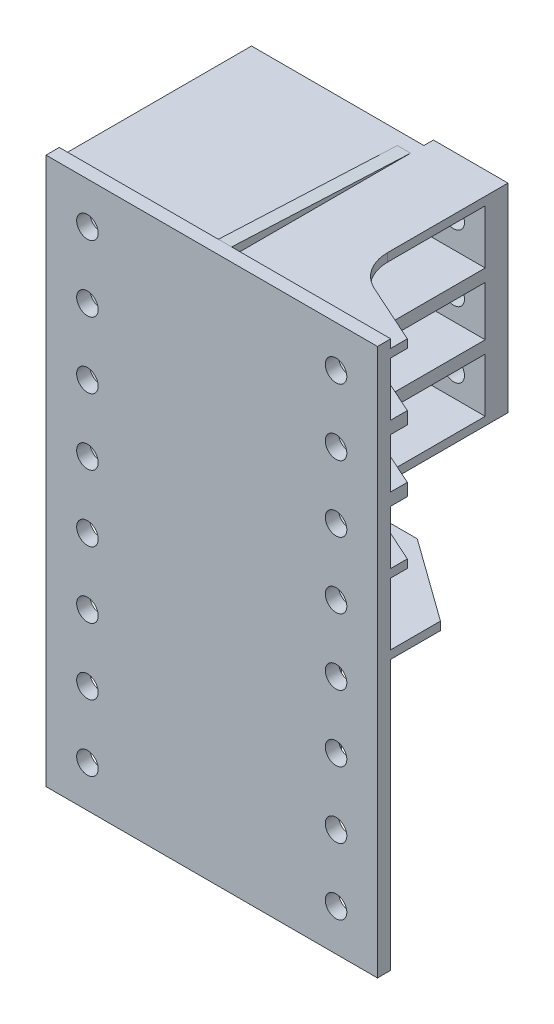
from build123d import *

# Parameters (mm, degrees)
SKETCH_1_W                       = 400
SKETCH_1_H                       = 660
EXTRUDE_1_DEPTH                  = 16
SKETCH_2_R                       = 13
CUT_EXTRUDE_1_DEPTH              = 772.917093994
PATTERN_LINEAR_1_COUNT           = 2
PATTERN_LINEAR_1_PITCH           = 300
PATTERN_LINEAR_1_COUNT_DIR2      = 8
PATTERN_LINEAR_1_PITCH_DIR2      = 80
SKETCH_3_W                       = 16
SKETCH_3_H                       = 660
EXTRUDE_2_DEPTH                  = 216
SKETCH_4_R                       = 13
CUT_EXTRUDE_2_DEPTH              = 730.854780076
SKETCH_5_W                       = 192
SKETCH_5_H                       = 10
EXTRUDE_3_DEPTH                  = 216
CUT_EXTRUDE_3_DEPTH              = 790.572035979
PATTERN_LINEAR_2_COUNT           = 2
PATTERN_LINEAR_2_PITCH           = 75
PATTERN_LINEAR_3_COUNT           = 2
PATTERN_LINEAR_3_PITCH           = 80
PATTERN_LINEAR_3_COPY_1_SKETCH_W = 192
PATTERN_LINEAR_3_COPY_1_SKETCH_H = 10
PATTERN_LINEAR_3_COPY_1_DEPTH    = 216
PATTERN_LINEAR_3_COPY_2_DEPTH    = 790.572035979
PATTERN_LINEAR_3_COPY_3_DEPTH    = 790.572035979
PATTERN_LINEAR_4_COUNT           = 2
PATTERN_LINEAR_4_PITCH           = 75
PATTERN_LINEAR_4_COPY_1_SKETCH_W = 192
PATTERN_LINEAR_4_COPY_1_SKETCH_H = 10
PATTERN_LINEAR_4_COPY_1_DEPTH    = 216
PATTERN_LINEAR_4_COPY_2_DEPTH    = 790.572035979
PATTERN_LINEAR_4_COPY_3_DEPTH    = 790.572035979
PATTERN_LINEAR_4_COPY_4_SKETCH_W = 192
PATTERN_LINEAR_4_COPY_4_SKETCH_H = 10
PATTERN_LINEAR_4_COPY_4_DEPTH    = 216
PATTERN_LINEAR_4_COPY_5_SKETCH_W = 192
PATTERN_LINEAR_4_COPY_5_SKETCH_H = 10
PATTERN_LINEAR_4_COPY_5_DEPTH    = 216
PATTERN_LINEAR_4_COPY_6_DEPTH    = 790.572035979
PATTERN_LINEAR_4_COPY_7_DEPTH    = 790.572035979
PATTERN_LINEAR_4_COPY_8_DEPTH    = 790.572035979
SKETCH_7_W                       = 400
SKETCH_7_H                       = 10
EXTRUDE_4_DEPTH                  = 132
CUT_EXTRUDE_4_DEPTH              = 10
SKETCH_9_W                       = 298
SKETCH_9_H                       = 240
EXTRUDE_5_DEPTH                  = 16
SKETCH_10_R                      = 13
CUT_EXTRUDE_5_DEPTH              = 806.868475621
PATTERN_LINEAR_6_COUNT           = 3
PATTERN_LINEAR_6_PITCH           = 80
PATTERN_LINEAR_7_COUNT           = 2
PATTERN_LINEAR_7_PITCH           = 120
PATTERN_LINEAR_7_COPY_1_SKETCH_R = 13
PATTERN_LINEAR_7_COPY_1_DEPTH    = 806.868475621
PATTERN_LINEAR_7_COPY_2_SKETCH_R = 13
PATTERN_LINEAR_7_COPY_2_DEPTH    = 806.868475621
PATTERN_LINEAR_8_COUNT           = 2
PATTERN_LINEAR_8_PITCH           = 80
PATTERN_LINEAR_8_COPY_1_SKETCH_R = 13
PATTERN_LINEAR_8_COPY_1_DEPTH    = 806.868475621
PATTERN_LINEAR_8_COPY_2_SKETCH_R = 13
PATTERN_LINEAR_8_COPY_2_DEPTH    = 806.868475621
SKETCH_13_W                      = 90
SKETCH_13_H                      = 240
SKETCH_13_R                      = 13
EXTRUDE_6_DEPTH                  = 11.5
SKETCH_12_W                      = 259.5
SKETCH_12_H                      = 660
CUT_EXTRUDE_6_DEPTH              = 815.211428316


with BuildPart() as part:
    # 草图1 → 凸台-拉伸1 (new body)
    with BuildSketch(Plane.XY):
        with Locations((200, 330)):
            Rectangle(SKETCH_1_W, SKETCH_1_H)
    extrude(amount=EXTRUDE_1_DEPTH)

    # 草图2 → 切除-拉伸1 (cut, through all)
    with BuildSketch(Plane.XY.offset(16)):
        with Locations((50, 610)):
            Circle(SKETCH_2_R)
    cut_extrude_1 = extrude(amount=-CUT_EXTRUDE_1_DEPTH, mode=Mode.SUBTRACT)

    # 阵列(线性)1: Cut-Extrude 1 2 × 8
    with Locations(*[(i * PATTERN_LINEAR_1_PITCH, -j * PATTERN_LINEAR_1_PITCH_DIR2, 0) for i in range(PATTERN_LINEAR_1_COUNT) for j in range(PATTERN_LINEAR_1_COUNT_DIR2) if (i, j) != (0, 0)]):
        add(cut_extrude_1, mode=Mode.SUBTRACT)

    # 草图3 → 凸台-拉伸2 (add)
    with BuildSketch(Plane.XY.offset(16)):
        with Locations((200, 330)):
            Rectangle(SKETCH_3_W, SKETCH_3_H)
    extrude(amount=EXTRUDE_2_DEPTH)

    # 草图4 → 切除-拉伸2 (cut, through all)
    with BuildSketch(Plane(origin=(208, 0, 0), x_dir=(0, 0, -1), z_dir=(1, 0, 0))):
        with Locations(Location((-93.5, 50, 0), (0, 0, 90))):
            Circle(SKETCH_4_R)
        with Locations(Location((-93.5, 130, 0), (0, 0, 90))):
            Circle(SKETCH_4_R)
        with Locations(Location((-93.5, 210, 0), (0, 0, 90))):
            Circle(SKETCH_4_R)
        Polygon((-232, 660), (-232, 650), (-16, 660), align=None)
        with BuildLine():
            Line((-232, 410), (-198.5, 410))
            ThreePointArc((-198.5, 410), (-163.144660941, 395.355339059), (-148.5, 360))
            Line((-148.5, 360), (-148.5, 0))
            Line((-148.5, 0), (-232, 0))
            Line((-232, 0), (-232, 410))
        make_face()
    extrude(amount=-CUT_EXTRUDE_2_DEPTH, mode=Mode.SUBTRACT)

    # 草图5 → 凸台-拉伸3 (add)
    with BuildSketch(Plane.XY.offset(16)):
        with Locations((304, 645)):
            Rectangle(SKETCH_5_W, SKETCH_5_H)
        with Locations((96, 645)):
            Rectangle(SKETCH_5_W, SKETCH_5_H)
    extrude_3 = extrude(amount=EXTRUDE_3_DEPTH)

    # 草图6 → 切除-拉伸3 (cut, through all)
    with BuildSketch(Plane.XZ.offset(-640)):
        with BuildLine():
            Line((298, 232), (298, 114.300395022))
            ThreePointArc((298, 114.300395022), (306.001372744, 87.168950007), (327.444612345, 68.721057178))
            Line((327.444612345, 68.721057178), (400, 36))
            Line((400, 36), (400, 232))
            Line((400, 232), (298, 232))
        make_face()
    cut_extrude_3 = extrude(amount=-CUT_EXTRUDE_3_DEPTH, mode=Mode.SUBTRACT)

    # 阵列(线性)2: 凸台-拉伸3, 切除-拉伸3 ×2
    with Locations(*[(0, -i * PATTERN_LINEAR_2_PITCH, 0) for i in range(1, PATTERN_LINEAR_2_COUNT)]):
        add(extrude_3)
        add(cut_extrude_3, mode=Mode.SUBTRACT)

    # 阵列(线性)3: 凸台-拉伸3 ×2
    with Locations(*[(0, -i * PATTERN_LINEAR_3_PITCH, 0) for i in range(1, PATTERN_LINEAR_3_COUNT)]):
        add(extrude_3)

    # 阵列(线性)3 copy 1 sketch → 阵列(线性)3 copy 1 (add)
    with BuildSketch(Plane(origin=(0, -155, 16), x_dir=(1, 0, 0), z_dir=(0, 0, 1))):
        with Locations((304, 645)):
            Rectangle(PATTERN_LINEAR_3_COPY_1_SKETCH_W, PATTERN_LINEAR_3_COPY_1_SKETCH_H)
        with Locations((96, 645)):
            Rectangle(PATTERN_LINEAR_3_COPY_1_SKETCH_W, PATTERN_LINEAR_3_COPY_1_SKETCH_H)
    extrude(amount=PATTERN_LINEAR_3_COPY_1_DEPTH)

    # 阵列(线性)3 copy 2 sketch → 阵列(线性)3 copy 2 (cut, through all)
    with BuildSketch(Plane.XZ.offset(-485)):
        with BuildLine():
            Line((298, 232), (298, 114.300395022))
            ThreePointArc((298, 114.300395022), (306.001372744, 87.168950007), (327.444612345, 68.721057178))
            Line((327.444612345, 68.721057178), (400, 36))
            Line((400, 36), (400, 232))
            Line((400, 232), (298, 232))
        make_face()
    extrude(amount=-PATTERN_LINEAR_3_COPY_2_DEPTH, mode=Mode.SUBTRACT)

    # 阵列(线性)3 copy 3 sketch → 阵列(线性)3 copy 3 (cut, through all)
    with BuildSketch(Plane.XZ.offset(-560)):
        with BuildLine():
            Line((298, 232), (298, 114.300395022))
            ThreePointArc((298, 114.300395022), (306.001372744, 87.168950007), (327.444612345, 68.721057178))
            Line((327.444612345, 68.721057178), (400, 36))
            Line((400, 36), (400, 232))
            Line((400, 232), (298, 232))
        make_face()
    extrude(amount=-PATTERN_LINEAR_3_COPY_3_DEPTH, mode=Mode.SUBTRACT)

    # 阵列(线性)4: 凸台-拉伸3 ×2
    with Locations(*[(0, -i * PATTERN_LINEAR_4_PITCH, 0) for i in range(1, PATTERN_LINEAR_4_COUNT)]):
        add(extrude_3)

    # 阵列(线性)4 copy 1 sketch → 阵列(线性)4 copy 1 (add)
    with BuildSketch(Plane(origin=(0, -150, 16), x_dir=(1, 0, 0), z_dir=(0, 0, 1))):
        with Locations((304, 645)):
            Rectangle(PATTERN_LINEAR_4_COPY_1_SKETCH_W, PATTERN_LINEAR_4_COPY_1_SKETCH_H)
        with Locations((96, 645)):
            Rectangle(PATTERN_LINEAR_4_COPY_1_SKETCH_W, PATTERN_LINEAR_4_COPY_1_SKETCH_H)
    extrude(amount=PATTERN_LINEAR_4_COPY_1_DEPTH)

    # 阵列(线性)4 copy 2 sketch → 阵列(线性)4 copy 2 (cut, through all)
    with BuildSketch(Plane.XZ.offset(-490)):
        with BuildLine():
            Line((298, 232), (298, 114.300395022))
            ThreePointArc((298, 114.300395022), (306.001372744, 87.168950007), (327.444612345, 68.721057178))
            Line((327.444612345, 68.721057178), (400, 36))
            Line((400, 36), (400, 232))
            Line((400, 232), (298, 232))
        make_face()
    extrude(amount=-PATTERN_LINEAR_4_COPY_2_DEPTH, mode=Mode.SUBTRACT)

    # 阵列(线性)4 copy 3 sketch → 阵列(线性)4 copy 3 (cut, through all)
    with BuildSketch(Plane.XZ.offset(-565)):
        with BuildLine():
            Line((298, 232), (298, 114.300395022))
            ThreePointArc((298, 114.300395022), (306.001372744, 87.168950007), (327.444612345, 68.721057178))
            Line((327.444612345, 68.721057178), (400, 36))
            Line((400, 36), (400, 232))
            Line((400, 232), (298, 232))
        make_face()
    extrude(amount=-PATTERN_LINEAR_4_COPY_3_DEPTH, mode=Mode.SUBTRACT)

    # 阵列(线性)4 copy 4 sketch → 阵列(线性)4 copy 4 (add)
    with BuildSketch(Plane(origin=(0, -155, 16), x_dir=(1, 0, 0), z_dir=(0, 0, 1))):
        with Locations((304, 645)):
            Rectangle(PATTERN_LINEAR_4_COPY_4_SKETCH_W, PATTERN_LINEAR_4_COPY_4_SKETCH_H)
        with Locations((96, 645)):
            Rectangle(PATTERN_LINEAR_4_COPY_4_SKETCH_W, PATTERN_LINEAR_4_COPY_4_SKETCH_H)
    extrude(amount=PATTERN_LINEAR_4_COPY_4_DEPTH)

    # 阵列(线性)4 copy 5 sketch → 阵列(线性)4 copy 5 (add)
    with BuildSketch(Plane(origin=(0, -230, 16), x_dir=(1, 0, 0), z_dir=(0, 0, 1))):
        with Locations((304, 645)):
            Rectangle(PATTERN_LINEAR_4_COPY_5_SKETCH_W, PATTERN_LINEAR_4_COPY_5_SKETCH_H)
        with Locations((96, 645)):
            Rectangle(PATTERN_LINEAR_4_COPY_5_SKETCH_W, PATTERN_LINEAR_4_COPY_5_SKETCH_H)
    extrude(amount=PATTERN_LINEAR_4_COPY_5_DEPTH)

    # 阵列(线性)4 copy 6 sketch → 阵列(线性)4 copy 6 (cut, through all)
    with BuildSketch(Plane.XZ.offset(-410)):
        with BuildLine():
            Line((298, 232), (298, 114.300395022))
            ThreePointArc((298, 114.300395022), (306.001372744, 87.168950007), (327.444612345, 68.721057178))
            Line((327.444612345, 68.721057178), (400, 36))
            Line((400, 36), (400, 232))
            Line((400, 232), (298, 232))
        make_face()
    extrude(amount=-PATTERN_LINEAR_4_COPY_6_DEPTH, mode=Mode.SUBTRACT)

    # 阵列(线性)4 copy 7 sketch → 阵列(线性)4 copy 7 (cut, through all)
    with BuildSketch(Plane.XZ.offset(-485)):
        with BuildLine():
            Line((298, 232), (298, 114.300395022))
            ThreePointArc((298, 114.300395022), (306.001372744, 87.168950007), (327.444612345, 68.721057178))
            Line((327.444612345, 68.721057178), (400, 36))
            Line((400, 36), (400, 232))
            Line((400, 232), (298, 232))
        make_face()
    extrude(amount=-PATTERN_LINEAR_4_COPY_7_DEPTH, mode=Mode.SUBTRACT)

    # 阵列(线性)4 copy 8 sketch → 阵列(线性)4 copy 8 (cut, through all)
    with BuildSketch(Plane.XZ.offset(-565)):
        with BuildLine():
            Line((298, 232), (298, 114.300395022))
            ThreePointArc((298, 114.300395022), (306.001372744, 87.168950007), (327.444612345, 68.721057178))
            Line((327.444612345, 68.721057178), (400, 36))
            Line((400, 36), (400, 232))
            Line((400, 232), (298, 232))
        make_face()
    extrude(amount=-PATTERN_LINEAR_4_COPY_8_DEPTH, mode=Mode.SUBTRACT)

    # 草图7 → 凸台-拉伸4 (add)
    with BuildSketch(Plane.XY.offset(16)):
        with Locations((200, 330)):
            Rectangle(SKETCH_7_W, SKETCH_7_H)
    extrude(amount=EXTRUDE_4_DEPTH)

    # 草图8 → 切除-拉伸4 (cut)
    with BuildSketch(Plane(origin=(0, 325, 0), x_dir=(-1, 0, 0), z_dir=(0, -1, 0))):
        Polygon((-400, -148), (-300, -148), (-400, -76), align=None)
        Polygon((0, -148), (-100, -148), (0, -76), align=None)
    extrude(amount=-CUT_EXTRUDE_4_DEPTH, mode=Mode.SUBTRACT)

    # 草图9 → 凸台-拉伸5 (add)
    with BuildSketch(Plane.XY.offset(232)):
        with Locations((149, 530)):
            Rectangle(SKETCH_9_W, SKETCH_9_H)
    extrude(amount=EXTRUDE_5_DEPTH)

    # 草图10 → 切除-拉伸5 (cut, through all)
    with BuildSketch(Plane(origin=(0, 0, 232), x_dir=(-1, 0, 0), z_dir=(0, 0, -1))):
        with Locations((-140, 450)):
            Circle(SKETCH_10_R)
    cut_extrude_5 = extrude(amount=-CUT_EXTRUDE_5_DEPTH, mode=Mode.SUBTRACT)

    # 阵列(线性)6: 切除-拉伸5 ×3
    with Locations(*[(0, i * PATTERN_LINEAR_6_PITCH, 0) for i in range(1, PATTERN_LINEAR_6_COUNT)]):
        add(cut_extrude_5, mode=Mode.SUBTRACT)

    # 阵列(线性)7: 切除-拉伸5 ×2
    with Locations(*[(i * PATTERN_LINEAR_7_PITCH, 0, 0) for i in range(1, PATTERN_LINEAR_7_COUNT)]):
        add(cut_extrude_5, mode=Mode.SUBTRACT)

    # 阵列(线性)7 copy 1 sketch → 阵列(线性)7 copy 1 (cut, through all)
    with BuildSketch(Plane(origin=(120, 80, 232), x_dir=(-1, 0, 0), z_dir=(0, 0, -1))):
        with Locations((-140, 450)):
            Circle(PATTERN_LINEAR_7_COPY_1_SKETCH_R)
    extrude(amount=-PATTERN_LINEAR_7_COPY_1_DEPTH, mode=Mode.SUBTRACT)

    # 阵列(线性)7 copy 2 sketch → 阵列(线性)7 copy 2 (cut, through all)
    with BuildSketch(Plane(origin=(120, 160, 232), x_dir=(-1, 0, 0), z_dir=(0, 0, -1))):
        with Locations((-140, 450)):
            Circle(PATTERN_LINEAR_7_COPY_2_SKETCH_R)
    extrude(amount=-PATTERN_LINEAR_7_COPY_2_DEPTH, mode=Mode.SUBTRACT)

    # 阵列(线性)8: 切除-拉伸5 ×2
    with Locations(*[(-i * PATTERN_LINEAR_8_PITCH, 0, 0) for i in range(1, PATTERN_LINEAR_8_COUNT)]):
        add(cut_extrude_5, mode=Mode.SUBTRACT)

    # 阵列(线性)8 copy 1 sketch → 阵列(线性)8 copy 1 (cut, through all)
    with BuildSketch(Plane(origin=(-80, 80, 232), x_dir=(-1, 0, 0), z_dir=(0, 0, -1))):
        with Locations((-140, 450)):
            Circle(PATTERN_LINEAR_8_COPY_1_SKETCH_R)
    extrude(amount=-PATTERN_LINEAR_8_COPY_1_DEPTH, mode=Mode.SUBTRACT)

    # 阵列(线性)8 copy 2 sketch → 阵列(线性)8 copy 2 (cut, through all)
    with BuildSketch(Plane(origin=(-80, 160, 232), x_dir=(-1, 0, 0), z_dir=(0, 0, -1))):
        with Locations((-140, 450)):
            Circle(PATTERN_LINEAR_8_COPY_2_SKETCH_R)
    extrude(amount=-PATTERN_LINEAR_8_COPY_2_DEPTH, mode=Mode.SUBTRACT)

    # 草图13 → 凸台-拉伸6 (add)
    with BuildSketch(Plane.XY.offset(248)):
        with Locations((253, 530)):
            Rectangle(SKETCH_13_W, SKETCH_13_H)
        with Locations(Location((260, 610, 0), (0, 0, 180))):
            Circle(SKETCH_13_R, mode=Mode.SUBTRACT)
        with Locations(Location((260, 530, 0), (0, 0, 180))):
            Circle(SKETCH_13_R, mode=Mode.SUBTRACT)
        with Locations(Location((260, 450, 0), (0, 0, 180))):
            Circle(SKETCH_13_R, mode=Mode.SUBTRACT)
    extrude(amount=EXTRUDE_6_DEPTH)

    # 镜向1: part across plane


with BuildPart() as part_1:
    add(part.part)
    add(part.part.mirror(Plane.XY))

    # 草图12 → 切除-拉伸6 (cut, through all)
    with BuildSketch(Plane.ZY):
        with Locations((129.75, 330)):
            Rectangle(SKETCH_12_W, SKETCH_12_H)
    extrude(amount=-CUT_EXTRUDE_6_DEPTH, mode=Mode.SUBTRACT)


solid = part_1.part
